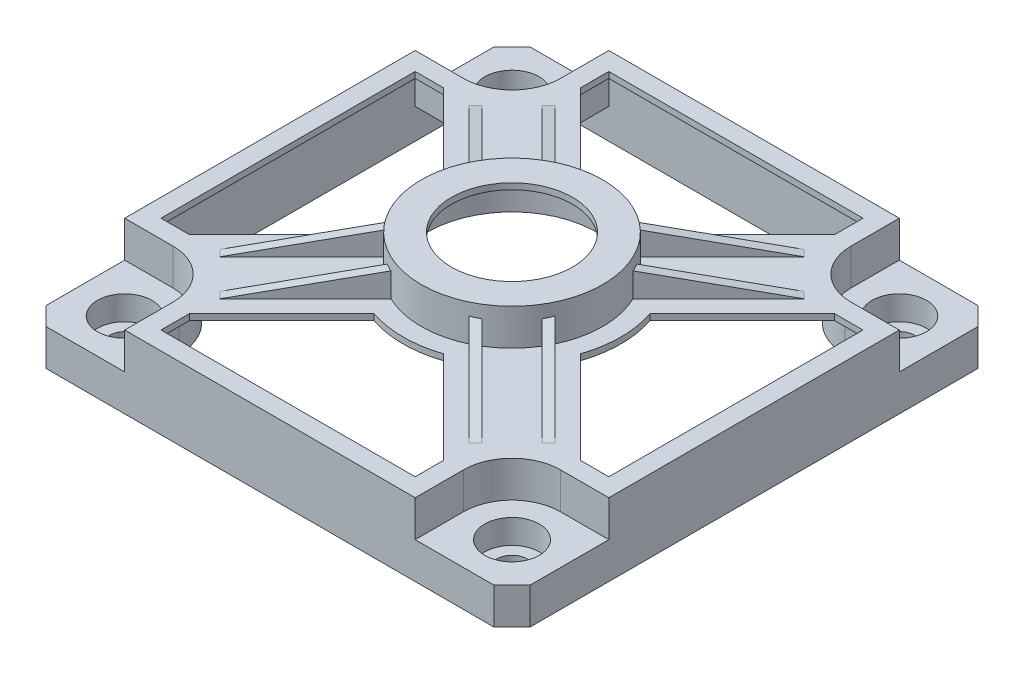
from build123d import *

# Parameters (mm, degrees)
SKETCH1_R               = 10
BOSS_EXTRUDE1_DEPTH     = 12
SKETCH2_R               = 15
SKETCH2_R_2             = 10
BOSS_EXTRUDE2_DEPTH     = 6
CUT_EXTRUDE1_DEPTH      = 58.827329179
CIRPATTERN1_COUNT       = 4
SKETCH1_4_R             = 4.5
BOSS_EXTRUDE3_DEPTH     = 6
SKETCH1_5_R             = 4.5
SKETCH1_5_R_2           = 3.5
SKETCH1_5_R_3           = 2.5
BOSS_EXTRUDE4_DEPTH     = 2
CIRPATTERN2_COUNT       = 4
CHAMFER3_SIZE           = 3
SHELL1_T                = -1
CUT_EXTRUDE3_START      = -11
SKETCH9_R               = 11
CUT_EXTRUDE3_DEPTH      = 11
SKETCH10_R              = 11
CUT_EXTRUDE4_DEPTH      = 6
BOSS_EXTRUDE5_DEPTH     = 6
BOSS_EXTRUDE5_2_DEPTH   = 6
CUT_EXTRUDE7_DEPTH      = 60.363288319
CUT_EXTRUDE7_DEPTH_BACK = 60.363288319
SKETCH14_OUTSIDE_W      = 138.05
SKETCH14_OUTSIDE_H      = 42.912
CIRPATTERN5_COUNT       = 4
CUT_EXTRUDE8_DEPTH      = 59.787753827
CUT_EXTRUDE8_DEPTH_BACK = 59.787753827
SKETCH15_R              = 2.5


with BuildPart() as part:
    # Sketch1 → Boss-Extrude1 (new body)
    with BuildSketch(Plane(origin=(0, 0, 0), x_dir=(1, 0, 0), z_dir=(0, 1, 0))):
        with BuildLine():
            Line((24, 40), (-24, 40))
            Line((-24, 40), (-24, 32))
            ThreePointArc((-24, 32), (-26.343145751, 26.343145751), (-32, 24))
            Line((-32, 24), (-40, 24))
            Line((-40, 24), (-40, -24))
            Line((-40, -24), (-32, -24))
            ThreePointArc((-32, -24), (-26.343145751, -26.343145751), (-24, -32))
            Line((-24, -32), (-24, -40))
            Line((-24, -40), (24, -40))
            Line((24, -40), (24, -32))
            ThreePointArc((24, -32), (26.343145751, -26.343145751), (32, -24))
            Line((32, -24), (40, -24))
            Line((40, -24), (40, 24))
            Line((40, 24), (32, 24))
            ThreePointArc((32, 24), (26.343145751, 26.343145751), (24, 32))
            Line((24, 32), (24, 40))
        make_face()
        with Locations(Location((0, 0, 0), (0, 0, 270))):
            Circle(SKETCH1_R, mode=Mode.SUBTRACT)
    extrude(amount=BOSS_EXTRUDE1_DEPTH)

    # Sketch2 → Boss-Extrude2 (add)
    with BuildSketch(Plane(origin=(0, 12, 0), x_dir=(1, 0, 0), z_dir=(0, 1, 0))):
        with Locations(Location((0, 0, 0), (0, 0, 270))):
            Circle(SKETCH2_R)
        with Locations(Location((0, 0, 0), (0, 0, 270))):
            Circle(SKETCH2_R_2, mode=Mode.SUBTRACT)
    extrude(amount=BOSS_EXTRUDE2_DEPTH)

    # Sketch3 → Cut-Extrude1 (cut, through all)
    with BuildSketch(Plane(origin=(0, 12, 0), x_dir=(1, 0, 0), z_dir=(0, 1, 0))):
        with BuildLine():
            Line((21, -37), (-21, -37))
            Line((-21, -37), (-21, -32.313708499))
            Line((-21, -32.313708499), (-5.744900001, -17.0586085))
            ThreePointArc((-5.744900001, -17.0586085), (0, -18), (5.744900001, -17.0586085))
            Line((5.744900001, -17.0586085), (21, -32.313708499))
            Line((21, -32.313708499), (21, -37))
        make_face()
    cut_extrude1 = extrude(amount=-CUT_EXTRUDE1_DEPTH, mode=Mode.SUBTRACT)

    # CirPattern1: Cut-Extrude1 ×4 about axis
    cirpattern1_axis = Axis((0, 0, 0), (0, 1, 0))
    for i in range(1, CIRPATTERN1_COUNT):
        add(cut_extrude1.rotate(cirpattern1_axis, i * 360 / CIRPATTERN1_COUNT), mode=Mode.SUBTRACT)

    # Sketch1<4> → Boss-Extrude3 (add)
    with BuildSketch(Plane(origin=(0, 0, 0), x_dir=(1, 0, 0), z_dir=(0, 1, 0))):
        with BuildLine():
            Line((-24, 32), (-24, 40))
            Line((-24, 40), (-40, 40))
            Line((-40, 40), (-40, 24))
            Line((-40, 24), (-32, 24))
            ThreePointArc((-32, 24), (-26.343145751, 26.343145751), (-24, 32))
        make_face()
        with Locations(Location((-32, 32, 0), (0, 0, 270))):
            Circle(SKETCH1_4_R, mode=Mode.SUBTRACT)
    boss_extrude3 = extrude(amount=BOSS_EXTRUDE3_DEPTH)

    # Sketch1<5> → Boss-Extrude4 (add)
    # profile 1 of 3: a face of its own
    with BuildSketch(Plane(origin=(0, 0, 0), x_dir=(1, 0, 0), z_dir=(0, 1, 0))):
        with Locations(Location((-32, 32, 0), (0, 0, 270))):
            Circle(SKETCH1_5_R)
        with Locations((-32, 32)):
            Circle(SKETCH1_5_R_2, mode=Mode.SUBTRACT)
    # profile 2 of 3: a face of its own
    with BuildSketch(Plane(origin=(0, 0, 0), x_dir=(1, 0, 0), z_dir=(0, 1, 0))):
        with Locations((-32, 32)):
            Circle(SKETCH1_5_R_2)
        with Locations((-32, 32)):
            Circle(SKETCH1_5_R_3, mode=Mode.SUBTRACT)
    # profile 3 of 3: a face of its own
    with BuildSketch(Plane(origin=(0, 0, 0), x_dir=(1, 0, 0), z_dir=(0, 1, 0))):
        with Locations((-32, 32)):
            Circle(SKETCH1_5_R_3)
    boss_extrude4 = extrude(amount=BOSS_EXTRUDE4_DEPTH)

    # CirPattern2: Boss-Extrude3, Boss-Extrude4 ×4 about axis
    cirpattern2_axis = Axis((0, 0, 0), (0, 1, 0))
    add([boss_extrude3.rotate(cirpattern2_axis, i * 360 / CIRPATTERN2_COUNT) for i in range(1, CIRPATTERN2_COUNT)])
    add([boss_extrude4.rotate(cirpattern2_axis, i * 360 / CIRPATTERN2_COUNT) for i in range(1, CIRPATTERN2_COUNT)])

    # Chamfer3
    chamfer3_edges = [part.edges().sort_by_distance(p)[0] for p in [
        (-40, 3, -40),
        (40, 3, -40),
        (40, 3, 40),
        (-40, 3, 40),
    ]]
    chamfer(chamfer3_edges, length=CHAMFER3_SIZE)

    # Shell1
    shell1_openings = [part.faces().sort_by_distance(p)[0] for p in [
        (0, 0, -28.947670916),
    ]]
    offset(amount=SHELL1_T, openings=shell1_openings, kind=Kind.INTERSECTION)

    # Sketch9 → Cut-Extrude3 (cut)
    with BuildSketch(Plane.XZ.offset(CUT_EXTRUDE3_START)):
        with Locations(Location((0, 0, 0), (0, 0, 90))):
            Circle(SKETCH9_R)
        with BuildLine():
            Line((22, 38), (-22, 38))
            Line((-22, 38), (-22, 31.899494937))
            Line((-22, 31.899494937), (-6.004703682, 15.904198618))
            ThreePointArc((-6.004703682, 15.904198618), (0, 17), (6.004703682, 15.904198618))
            Line((6.004703682, 15.904198618), (22, 31.899494937))
            Line((22, 31.899494937), (22, 38))
        make_face()
        with BuildLine():
            Line((-38, 22), (-38, -22))
            Line((-38, -22), (-31.899494937, -22))
            Line((-31.899494937, -22), (-15.904198618, -6.004703682))
            ThreePointArc((-15.904198618, -6.004703682), (-17, 0), (-15.904198618, 6.004703682))
            Line((-15.904198618, 6.004703682), (-31.899494937, 22))
            Line((-31.899494937, 22), (-38, 22))
        make_face()
        with BuildLine():
            Line((-22, -38), (22, -38))
            Line((22, -38), (22, -31.899494937))
            Line((22, -31.899494937), (6.004703682, -15.904198618))
            ThreePointArc((6.004703682, -15.904198618), (0, -17), (-6.004703682, -15.904198618))
            Line((-6.004703682, -15.904198618), (-22, -31.899494937))
            Line((-22, -31.899494937), (-22, -38))
        make_face()
        with BuildLine():
            Line((38, -22), (38, 22))
            Line((38, 22), (31.899494937, 22))
            Line((31.899494937, 22), (15.904198618, 6.004703682))
            ThreePointArc((15.904198618, 6.004703682), (17, 0), (15.904198618, -6.004703682))
            Line((15.904198618, -6.004703682), (31.899494937, -22))
            Line((31.899494937, -22), (38, -22))
        make_face()
    extrude(amount=CUT_EXTRUDE3_DEPTH, mode=Mode.SUBTRACT)

    # Sketch10 → Cut-Extrude4 (cut)
    with BuildSketch(Plane.XZ.offset(-11)):
        Circle(SKETCH10_R)
    extrude(amount=-CUT_EXTRUDE4_DEPTH, mode=Mode.SUBTRACT)

    # Sketch15 → Cut-Extrude8 (cut, two sides: drawn at the far end of the back side and taken through both)
    with BuildSketch(Plane(origin=(0, 2, 0), x_dir=(1, 0, 0), z_dir=(0, 1, 0)).offset(-CUT_EXTRUDE8_DEPTH_BACK)):
        with Locations(Location((-32, -32, 0), (0, 0, 270))):
            Circle(SKETCH15_R)
        with Locations(Location((-32, 32, 0), (0, 0, 270))):
            Circle(SKETCH15_R)
        with Locations(Location((32, 32, 0), (0, 0, 270))):
            Circle(SKETCH15_R)
        with Locations(Location((32, -32, 0), (0, 0, 270))):
            Circle(SKETCH15_R)
    extrude(amount=CUT_EXTRUDE8_DEPTH + CUT_EXTRUDE8_DEPTH_BACK, mode=Mode.SUBTRACT)


with BuildPart() as body_2:
    # Sketch12 → Boss-Extrude5 (new body)
    with BuildSketch(Plane(origin=(0, 12, 0), x_dir=(1, 0, 0), z_dir=(0, 1, 0))):
        with BuildLine():
            Line((-6.464466094, -13.535533906), (-20.606601718, -27.67766953))
            Line((-20.606601718, -27.67766953), (-21.66726189, -26.617009358))
            Line((-21.66726189, -26.617009358), (-7.838951938, -12.788699407))
            ThreePointArc((-7.838951938, -12.788699407), (-7.16145113, -13.180046195), (-6.464466094, -13.535533906))
        make_face()
    extrude(amount=BOSS_EXTRUDE5_DEPTH)


with BuildPart() as body_3:
    # Sketch12 → Boss-Extrude5 2 (new body)
    with BuildSketch(Plane(origin=(0, 12, 0), x_dir=(1, 0, 0), z_dir=(0, 1, 0))):
        with BuildLine():
            Line((-13.535533906, -6.464466094), (-27.67766953, -20.606601718))
            Line((-27.67766953, -20.606601718), (-26.617009358, -21.66726189))
            Line((-26.617009358, -21.66726189), (-12.788699407, -7.838951938))
            ThreePointArc((-12.788699407, -7.838951938), (-13.180046195, -7.16145113), (-13.535533906, -6.464466094))
        make_face()
    extrude(amount=BOSS_EXTRUDE5_2_DEPTH)


with BuildPart() as cut_extrude7_tool:
    # Sketch14 outside → Cut-Extrude7 (new, two sides: drawn at the far end of the back side and taken through both)
    with BuildSketch(Plane(origin=(0, 0, 0), x_dir=(0.7071067811865476, 0, -0.7071067811865476), z_dir=(0.7071067811865476, 0, 0.7071067811865476)).offset(-CUT_EXTRUDE7_DEPTH_BACK)):
        with Locations((0, 9)):
            Rectangle(SKETCH14_OUTSIDE_W, SKETCH14_OUTSIDE_H)
        Polygon((-14.142135624, 16), (-34.142135624, 12), (-14.142135624, 12), align=None, mode=Mode.SUBTRACT)
    extrude(amount=CUT_EXTRUDE7_DEPTH + CUT_EXTRUDE7_DEPTH_BACK)


with BuildPart() as body_3_1:
    add(body_3.part)

    # Cut-Extrude7: cut by cut_extrude7_tool
    add(cut_extrude7_tool.part, mode=Mode.SUBTRACT)


with BuildPart() as body_2_1:
    add(body_2.part)

    # Cut-Extrude7: cut by cut_extrude7_tool
    add(cut_extrude7_tool.part, mode=Mode.SUBTRACT)


with BuildPart() as cirpattern5_1:
    # CirPattern5: pattern copy
    add(body_2_1.part.rotate(Axis((0, 0, 0), (0, 1, 0)), 1 * 360 / CIRPATTERN5_COUNT))


with BuildPart() as cirpattern5_2:
    # CirPattern5: pattern copy
    add(body_2_1.part.rotate(Axis((0, 0, 0), (0, 1, 0)), 2 * 360 / CIRPATTERN5_COUNT))


with BuildPart() as cirpattern5_3:
    # CirPattern5: pattern copy
    add(body_2_1.part.rotate(Axis((0, 0, 0), (0, 1, 0)), 3 * 360 / CIRPATTERN5_COUNT))


with BuildPart() as cirpattern5_4:
    # CirPattern5: pattern copy
    add(body_3_1.part.rotate(Axis((0, 0, 0), (0, 1, 0)), 1 * 360 / CIRPATTERN5_COUNT))


with BuildPart() as cirpattern5_5:
    # CirPattern5: pattern copy
    add(body_3_1.part.rotate(Axis((0, 0, 0), (0, 1, 0)), 2 * 360 / CIRPATTERN5_COUNT))


with BuildPart() as cirpattern5_6:
    # CirPattern5: pattern copy
    add(body_3_1.part.rotate(Axis((0, 0, 0), (0, 1, 0)), 3 * 360 / CIRPATTERN5_COUNT))


with BuildPart() as cirpattern5_5_1:
    add(cirpattern5_5.part)

    # Combine1: union CirPattern5_3, body 2, CirPattern5_1, CirPattern5_6, body 3, CirPattern5_4, part, CirPattern5_2
    add(cirpattern5_3.part)
    add(body_2_1.part)
    add(cirpattern5_1.part)
    add(cirpattern5_6.part)
    add(body_3_1.part)
    add(cirpattern5_4.part)
    add(part.part)
    add(cirpattern5_2.part)


solid = cirpattern5_5_1.part
